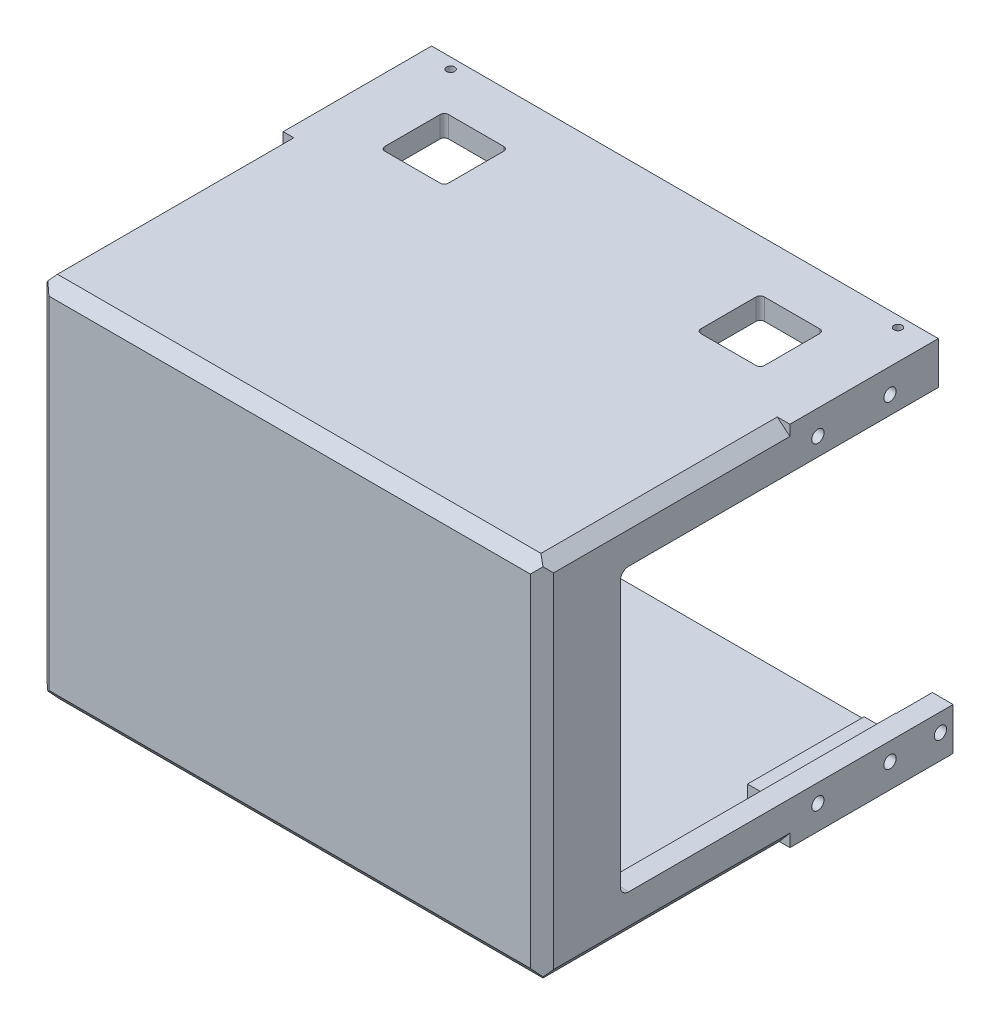
from build123d import *
from OCP.BRepFilletAPI import BRepFilletAPI_MakeChamfer

# Parameters (mm, degrees)
SKETCH1_W                                  = 119.52
SKETCH1_H                                  = 86.5
BOSS_EXTRUDE1_DEPTH                        = 88.24
SHELL1_T                                   = -5
CHAMFER1_SIZE                              = 2.5
CHAMFER1_SIZE2                             = 2.979383981
CHAMFER2_SIZE                              = 2.5
CHAMFER2_SIZE2                             = 2.979383981
CHAMFER3_SIZE                              = 2.5
CHAMFER3_SIZE2                             = 2.979383981
CUT_EXTRUDE1_REACH                         = 156.732
SKETCH3_W                                  = 70
SKETCH3_H                                  = 66.5
FILLET1_R                                  = 2
FILLET1_OF_MIRROR1_R                       = 2
SKETCH4_W                                  = 109.52
SKETCH4_H                                  = 5
BOSS_EXTRUDE2_DEPTH                        = 5
CUT_EXTRUDE2_REACH                         = 139.258
SKETCH5_R                                  = 0.95
BOSS_EXTRUDE3_DEPTH                        = 8.5
BOSS_EXTRUDE4_DEPTH                        = 5
BOSS_EXTRUDE6_DEPTH                        = 35
BOSS_EXTRUDE7_DEPTH                        = 8.5
BOSS_EXTRUDE8_DEPTH                        = 35
BOSS_EXTRUDE9_DEPTH                        = 38.5
SKETCH16_W                                 = 5
SKETCH16_H                                 = 27.5
BOSS_EXTRUDE10_DEPTH                       = 3
MIRROR7_COPY_1_SKETCH_W                    = 5
MIRROR7_COPY_1_SKETCH_H                    = 27.5
MIRROR7_COPY_1_DEPTH                       = 3
SKETCH15_R                                 = 1.45
CUT_EXTRUDE5_DEPTH                         = 8
MIRROR8_AT_THE_SECOND_PLANE_COPY_1_SKETC_R = 1.45
MIRROR8_AT_THE_SECOND_PLANE_COPY_1_DEPTH   = 8
SKETCH17_R                                 = 1.45
CUT_EXTRUDE6_DEPTH                         = 8
SKETCH18_R                                 = 1.45
CUT_EXTRUDE7_DEPTH                         = 8
SKETCH19_W                                 = 15
SKETCH19_H                                 = 15
CUT_EXTRUDE8_DEPTH                         = 5
FILLET2_R                                  = 1
FILLET2_OF_MIRROR10_R                      = 1


with BuildPart() as part:
    # Sketch1 → Boss-Extrude1 (new body)
    with BuildSketch(Plane.XY):
        Rectangle(SKETCH1_W, SKETCH1_H)
    extrude(amount=BOSS_EXTRUDE1_DEPTH)

    # Shell1
    shell1_openings = [part.faces().sort_by_distance(p)[0] for p in [
        (0, 0, 0),
    ]]
    offset(amount=SHELL1_T, openings=shell1_openings, kind=Kind.INTERSECTION)

    # Chamfer1: one chamfer whose edges measure the first distance from different faces: ONE call of the kernel's chamfer builder (chamfer() names one face for all edges)
    chamfer1_edges_1 = [part.edges().sort_by_distance(p)[0] for p in [
        (59.76, 0, 88.24),
    ]]
    chamfer1_side_1 = [part.faces().sort_by_distance(p)[0] for p in [
        (59.76, 0, 44.12),
    ]]
    chamfer1_edges_2 = [part.edges().sort_by_distance(p)[0] for p in [
        (0, 43.25, 88.24),
    ]]
    chamfer1_side_2 = [part.faces().sort_by_distance(p)[0] for p in [
        (0, 43.25, 44.12),
    ]]
    chamfer1_edges_3 = [part.edges().sort_by_distance(p)[0] for p in [
        (-59.76, 0, 88.24),
    ]]
    chamfer1_side_3 = [part.faces().sort_by_distance(p)[0] for p in [
        (-59.76, 0, 44.12),
    ]]
    chamfer1_edges_4 = [part.edges().sort_by_distance(p)[0] for p in [
        (0, -43.25, 88.24),
    ]]
    chamfer1_side_4 = [part.faces().sort_by_distance(p)[0] for p in [
        (0, -43.25, 44.12),
    ]]
    chamfer1 = BRepFilletAPI_MakeChamfer(part.part.solid().wrapped)
    for e in chamfer1_edges_1:
        chamfer1.Add(CHAMFER1_SIZE, CHAMFER1_SIZE2, e.wrapped, chamfer1_side_1[0].wrapped)  # the first distance lies on this face
    for e in chamfer1_edges_2:
        chamfer1.Add(CHAMFER1_SIZE, CHAMFER1_SIZE2, e.wrapped, chamfer1_side_2[0].wrapped)  # the first distance lies on this face
    for e in chamfer1_edges_3:
        chamfer1.Add(CHAMFER1_SIZE, CHAMFER1_SIZE2, e.wrapped, chamfer1_side_3[0].wrapped)  # the first distance lies on this face
    for e in chamfer1_edges_4:
        chamfer1.Add(CHAMFER1_SIZE, CHAMFER1_SIZE2, e.wrapped, chamfer1_side_4[0].wrapped)  # the first distance lies on this face
    add(Compound.cast(chamfer1.Shape()), mode=Mode.REPLACE)

    # Chamfer2
    chamfer2_edges = [part.edges().sort_by_distance(p)[0] for p in [
        (-59.76, 43.25, 42.87),
    ]]
    chamfer2_side = [part.faces().sort_by_distance(p)[0] for p in [
        (0, 43.25, 42.87),
    ]]
    chamfer(chamfer2_edges, length=CHAMFER2_SIZE, length2=CHAMFER2_SIZE2, reference=chamfer2_side[0])

    # Chamfer3: one chamfer whose edges measure the first distance from different faces: ONE call of the kernel's chamfer builder (chamfer() names one face for all edges)
    chamfer3_edges_1 = [part.edges().sort_by_distance(p)[0] for p in [
        (59.76, -43.25, 42.87),
    ]]
    chamfer3_side_1 = [part.faces().sort_by_distance(p)[0] for p in [
        (0, -43.25, 42.87),
    ]]
    chamfer3_edges_2 = [part.edges().sort_by_distance(p)[0] for p in [
        (-59.76, -43.25, 42.87),
    ]]
    chamfer3_side_2 = [part.faces().sort_by_distance(p)[0] for p in [
        (-59.76, -1.489691991, 42.87),
    ]]
    chamfer3_edges_3 = [part.edges().sort_by_distance(p)[0] for p in [
        (59.76, 43.25, 42.87),
    ]]
    chamfer3_side_3 = [part.faces().sort_by_distance(p)[0] for p in [
        (59.76, 0, 42.87),
    ]]
    chamfer3 = BRepFilletAPI_MakeChamfer(part.part.solid().wrapped)
    for e in chamfer3_edges_1:
        chamfer3.Add(CHAMFER3_SIZE, CHAMFER3_SIZE2, e.wrapped, chamfer3_side_1[0].wrapped)  # the first distance lies on this face
    for e in chamfer3_edges_2:
        chamfer3.Add(CHAMFER3_SIZE, CHAMFER3_SIZE2, e.wrapped, chamfer3_side_2[0].wrapped)  # the first distance lies on this face
    for e in chamfer3_edges_3:
        chamfer3.Add(CHAMFER3_SIZE, CHAMFER3_SIZE2, e.wrapped, chamfer3_side_3[0].wrapped)  # the first distance lies on this face
    add(Compound.cast(chamfer3.Shape()), mode=Mode.REPLACE)

    # Sketch3 → Cut-Extrude1 (cut, up to next)
    with BuildSketch(Plane(origin=(59.76, 0, 0), x_dir=(0, 0, -1), z_dir=(1, 0, 0)), mode=Mode.PRIVATE) as cut_extrude1_sk1:
        with Locations((-35, 0)):
            Rectangle(SKETCH3_W, SKETCH3_H)
    cut_extrude1_tool1 = extrude(cut_extrude1_sk1.sketch, amount=-CUT_EXTRUDE1_REACH, mode=Mode.PRIVATE) & part.part
    cut_extrude1 = cut_extrude1_tool1.solids().sort_by_distance((59.76, 0, 35))[0]
    add(cut_extrude1, mode=Mode.SUBTRACT)

    # Fillet1
    fillet1_edges = [part.edges().sort_by_distance(p)[0] for p in [
        (57.26, -33.25, 70),
        (57.26, 33.25, 70),
    ]]
    fillet(fillet1_edges, radius=FILLET1_R)

    # Mirror1: Cut-Extrude1 across plane
    add(cut_extrude1.mirror(Plane(origin=(0, 0, 0), x_dir=(0, 0, 1), z_dir=(1, 0, 0))), mode=Mode.SUBTRACT)

    # Fillet1 of Mirror1
    fillet1_of_mirror1_edges = [part.edges().sort_by_distance(p)[0] for p in [
        (-57.26, -33.25, 70),
        (-57.26, 33.25, 70),
    ]]
    fillet(fillet1_of_mirror1_edges, radius=FILLET1_OF_MIRROR1_R)

    # Sketch4 → Boss-Extrude2 (add)
    with BuildSketch(Plane(origin=(0, 0, 0), x_dir=(-1, 0, 0), z_dir=(0, 0, -1))):
        with Locations((0, 40.75)):
            Rectangle(SKETCH4_W, SKETCH4_H)
    extrude(amount=BOSS_EXTRUDE2_DEPTH)

    # Sketch5 → Cut-Extrude2 (cut, up to next)
    with BuildSketch(Plane(origin=(0, 43.25, 0), x_dir=(1, 0, 0), z_dir=(0, 1, 0)), mode=Mode.PRIVATE) as cut_extrude2_sk1:
        with Locations(Location((-52.76, 2.5, 0), (0, 0, 270))):
            Circle(SKETCH5_R)
    cut_extrude2_tool1 = extrude(cut_extrude2_sk1.sketch, amount=-CUT_EXTRUDE2_REACH, mode=Mode.PRIVATE) & part.part
    # Sketch5 → Cut-Extrude2 (cut, up to next)
    with BuildSketch(Plane(origin=(0, 43.25, 0), x_dir=(1, 0, 0), z_dir=(0, 1, 0)), mode=Mode.PRIVATE) as cut_extrude2_sk2:
        with Locations(Location((52.76, 2.5, 0), (0, 0, 270))):
            Circle(SKETCH5_R)
    cut_extrude2_tool2 = extrude(cut_extrude2_sk2.sketch, amount=-CUT_EXTRUDE2_REACH, mode=Mode.PRIVATE) & part.part
    add(cut_extrude2_tool1.solids().sort_by_distance((-52.76, 43.25, -2.5))[0], mode=Mode.SUBTRACT)
    add(cut_extrude2_tool2.solids().sort_by_distance((52.76, 43.25, -2.5))[0], mode=Mode.SUBTRACT)

    # Sketch6 → Boss-Extrude3 (add)
    with BuildSketch(Plane(origin=(0, 0, 0), x_dir=(-1, 0, 0), z_dir=(0, 0, -1))):
        Polygon((-59.76, -33.25), (-54.86, -33.25), (-54.86, -43.25), (-57.26, -43.25), (-59.76, -40.270616019), align=None)
    extrude(amount=BOSS_EXTRUDE3_DEPTH)

    # Sketch8 → Boss-Extrude4 (add)
    with BuildSketch(Plane(origin=(0, 0, 0), x_dir=(-1, 0, 0), z_dir=(0, 0, -1))):
        Polygon((57.26, 43.25), (54.76, 43.25), (54.76, 38.25), (54.76, 33.25), (59.76, 33.25), (59.76, 40.270616019), align=None)
        Polygon((-54.76, 33.25), (-54.76, 38.25), (-54.76, 43.25), (-56.780616019, 43.25), (-59.76, 40.75), (-59.76, 33.25), align=None)
    extrude(amount=BOSS_EXTRUDE4_DEPTH)

    # Sketch10 → Boss-Extrude6 (add)
    with BuildSketch(Plane(origin=(0, 0, -5), x_dir=(-1, 0, 0), z_dir=(0, 0, -1))):
        Polygon((-59.76, 40.75), (-59.76, 43.25), (-56.780616019, 43.25), align=None)
    extrude(amount=-BOSS_EXTRUDE6_DEPTH)

    # Sketch11 → Boss-Extrude7 (add)
    with BuildSketch(Plane(origin=(0, 0, 0), x_dir=(-1, 0, 0), z_dir=(0, 0, -1))):
        Polygon((59.76, -33.25), (54.86, -33.25), (54.86, -43.25), (56.780616019, -43.25), (59.76, -40.75), align=None)
    extrude(amount=BOSS_EXTRUDE7_DEPTH)

    # Sketch13 → Boss-Extrude8 (add)
    with BuildSketch(Plane(origin=(0, 0, -5), x_dir=(-1, 0, 0), z_dir=(0, 0, -1))):
        Polygon((57.26, 43.25), (59.76, 43.25), (59.76, 40.270616019), align=None)
    extrude(amount=-BOSS_EXTRUDE8_DEPTH)

    # Sketch14 → Boss-Extrude9 (add)
    with BuildSketch(Plane(origin=(0, 0, -8.5), x_dir=(-1, 0, 0), z_dir=(0, 0, -1))):
        Polygon((-59.76, -40.270616019), (-59.76, -43.25), (-57.26, -43.25), align=None)
        Polygon((59.76, -40.75), (59.76, -43.25), (56.780616019, -43.25), align=None)
    extrude(amount=-BOSS_EXTRUDE9_DEPTH)

    # Sketch16 → Boss-Extrude10 (add)
    with BuildSketch(Plane.XZ.offset(-38.25)):
        with Locations((52.26, 16.25)):
            Rectangle(SKETCH16_W, SKETCH16_H)
    boss_extrude10 = extrude(amount=BOSS_EXTRUDE10_DEPTH)

    # Mirror6: Boss-Extrude10 across plane
    add(boss_extrude10.mirror(Plane(origin=(0, 0, 0), x_dir=(0, 0, 1), z_dir=(1, 0, 0))))

    # Mirror7: Boss-Extrude10 across plane
    add(boss_extrude10.mirror(Plane.ZX))

    # Mirror7 copy 1 sketch → Mirror7 copy 1 (add)
    with BuildSketch(Plane(origin=(0, -38.25, 0), x_dir=(-1, 0, 0), z_dir=(0, 1, 0))):
        with Locations((52.26, 16.25)):
            Rectangle(MIRROR7_COPY_1_SKETCH_W, MIRROR7_COPY_1_SKETCH_H)
    extrude(amount=MIRROR7_COPY_1_DEPTH)

    # Sketch15 → Cut-Extrude5 (cut)
    with BuildSketch(Plane(origin=(59.76, 0, 0), x_dir=(0, 0, -1), z_dir=(1, 0, 0))):
        with Locations((-6.4, 37.5)):
            Circle(SKETCH15_R)
        with Locations((-23.4, 37.5)):
            Circle(SKETCH15_R)
    cut_extrude5 = extrude(amount=-CUT_EXTRUDE5_DEPTH, mode=Mode.SUBTRACT)

    # Mirror8: Cut-Extrude5 across plane
    add(cut_extrude5.mirror(Plane.ZX), mode=Mode.SUBTRACT)

    # Mirror8 at the second plane: Cut-Extrude5 across plane
    add(cut_extrude5.mirror(Plane(origin=(0, 0, 0), x_dir=(0, 0, 1), z_dir=(1, 0, 0))), mode=Mode.SUBTRACT)

    # Mirror8 at the second plane copy 1 sketc → Mirror8 at the second plane copy 1 (cut)
    with BuildSketch(Plane(origin=(-59.76, 0, 0), x_dir=(0, 0, -1), z_dir=(-1, 0, 0))):
        with Locations((-6.4, 37.5)):
            Circle(MIRROR8_AT_THE_SECOND_PLANE_COPY_1_SKETC_R)
        with Locations((-23.4, 37.5)):
            Circle(MIRROR8_AT_THE_SECOND_PLANE_COPY_1_SKETC_R)
    extrude(amount=-MIRROR8_AT_THE_SECOND_PLANE_COPY_1_DEPTH, mode=Mode.SUBTRACT)

    # Sketch17 → Cut-Extrude6 (cut)
    with BuildSketch(Plane(origin=(59.76, 0, 0), x_dir=(0, 0, -1), z_dir=(1, 0, 0))):
        with Locations((5.5, -37.5)):
            Circle(SKETCH17_R)
    extrude(amount=-CUT_EXTRUDE6_DEPTH, mode=Mode.SUBTRACT)

    # Sketch18 → Cut-Extrude7 (cut)
    with BuildSketch(Plane(origin=(-54.86, 0, 0), x_dir=(0, 0, -1), z_dir=(1, 0, 0))):
        with Locations((5.5, -37.5)):
            Circle(SKETCH18_R)
    extrude(amount=-CUT_EXTRUDE7_DEPTH, mode=Mode.SUBTRACT)

    # Sketch19 → Cut-Extrude8 (cut)
    with BuildSketch(Plane(origin=(0, 43.25, 0), x_dir=(1, 0, 0), z_dir=(0, 1, 0))):
        with Locations((-37.26, -14.5)):
            Rectangle(SKETCH19_W, SKETCH19_H)
    cut_extrude8 = extrude(amount=-CUT_EXTRUDE8_DEPTH, mode=Mode.SUBTRACT)

    # Fillet2
    fillet2_edges = [part.edges().sort_by_distance(p)[0] for p in [
        (-44.76, 40.75, 22),
        (-44.76, 40.75, 7),
        (-29.76, 40.75, 7),
        (-29.76, 40.75, 22),
    ]]
    fillet(fillet2_edges, radius=FILLET2_R)

    # Mirror10: Cut-Extrude8 across plane
    add(cut_extrude8.mirror(Plane(origin=(0, 0, 0), x_dir=(0, 0, 1), z_dir=(1, 0, 0))), mode=Mode.SUBTRACT)

    # Fillet2 of Mirror10
    fillet2_of_mirror10_edges = [part.edges().sort_by_distance(p)[0] for p in [
        (44.76, 40.75, 22),
        (44.76, 40.75, 7),
        (29.76, 40.75, 7),
        (29.76, 40.75, 22),
    ]]
    fillet(fillet2_of_mirror10_edges, radius=FILLET2_OF_MIRROR10_R)


solid = part.part
